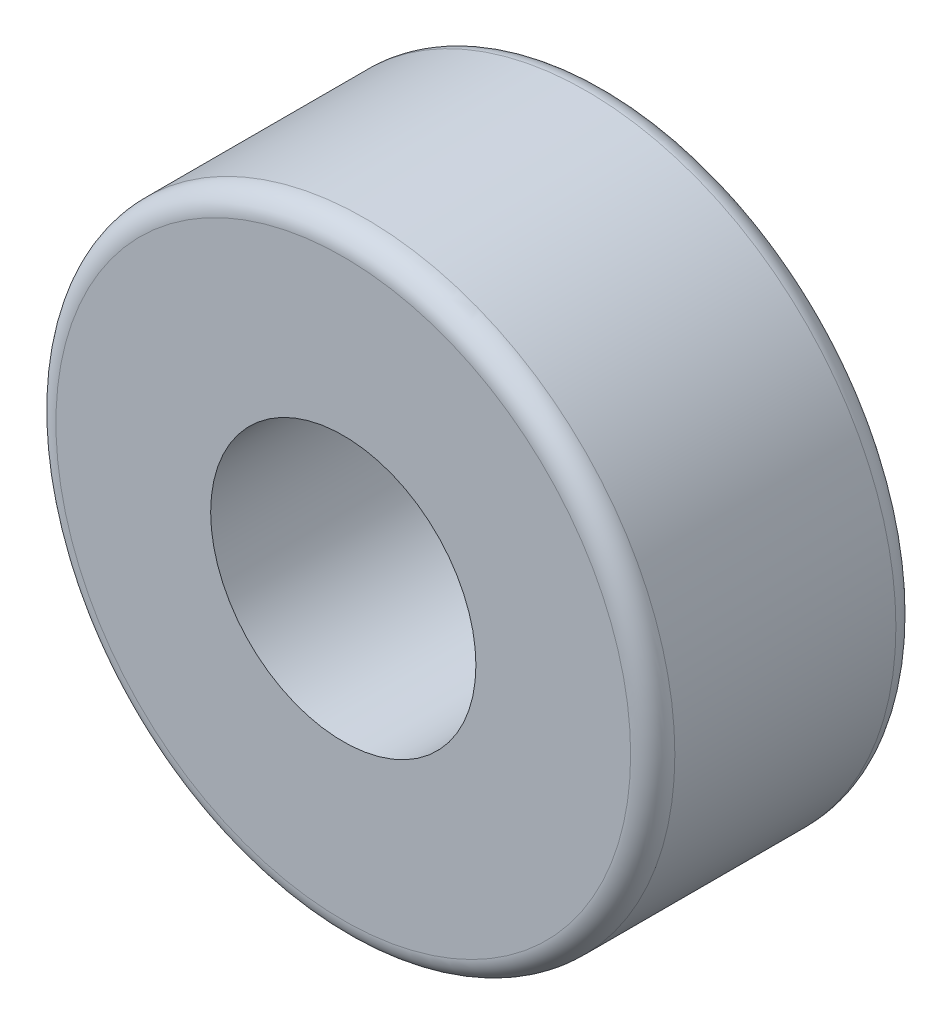
from build123d import *

# Parameters (mm, degrees)
ESBO_O1_R                = 7
ESBO_O1_R_2              = 3
RESSALTO_EXTRUS_O1_DEPTH = 6
FILETE1_R                = 0.5


with BuildPart() as part:
    # Esboço1 → Ressalto-extrusão1 (new body)
    with BuildSketch(Plane.XY):
        with Locations((0, 0.291100128)):
            Circle(ESBO_O1_R)
        with Locations((0, 0.291100128)):
            Circle(ESBO_O1_R_2, mode=Mode.SUBTRACT)
    extrude(amount=RESSALTO_EXTRUS_O1_DEPTH)

    # Filete1
    filete1_edges = [part.edges().sort_by_distance(p)[0] for p in [
        (-7, 0.291100128, 0),
        (-7, 0.291100128, 6),
    ]]
    fillet(filete1_edges, radius=FILETE1_R)


solid = part.part
